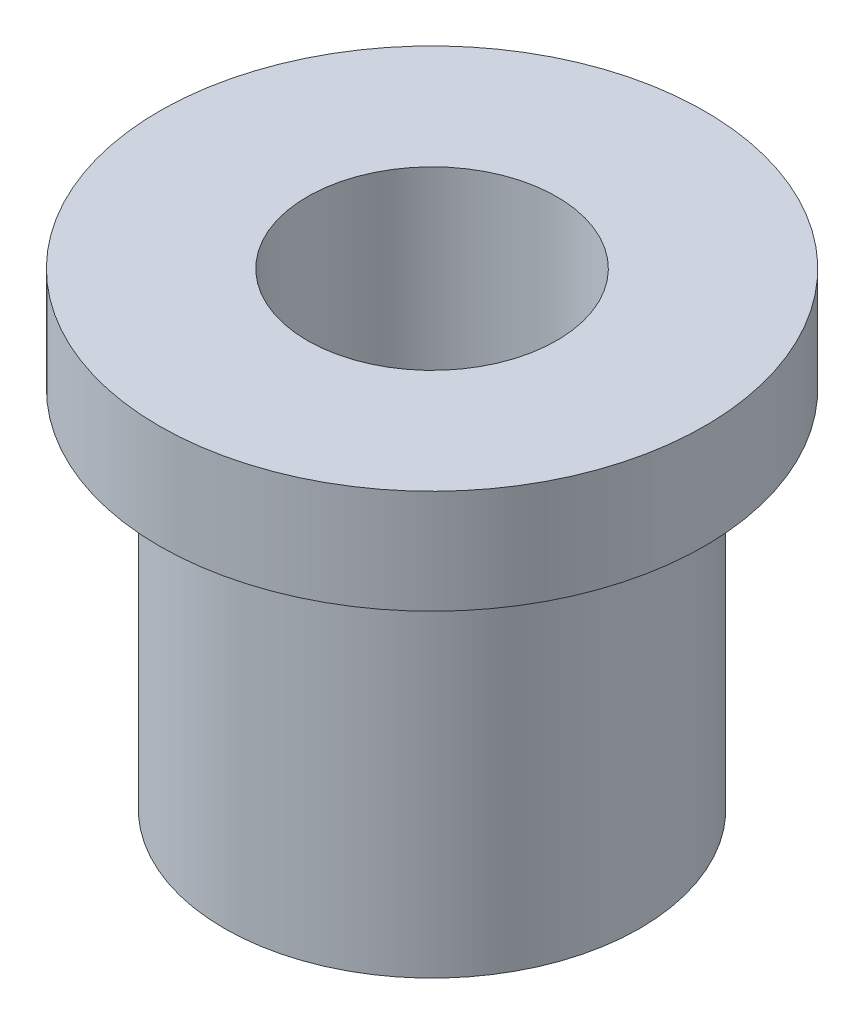
from build123d import *

# Parameters (mm, degrees)
SKETCH1_R           = 4
SKETCH1_R_2         = 2.4
BOSS_EXTRUDE1_DEPTH = 9
BOSS_EXTRUDE2_START = -2
SKETCH2_R           = 5.25
SKETCH2_R_2         = 2.4
BOSS_EXTRUDE2_DEPTH = 2


with BuildPart() as part:
    # Sketch1 → Boss-Extrude1 (new body)
    with BuildSketch(Plane(origin=(0, 0, 0), x_dir=(1, 0, 0), z_dir=(0, 1, 0))):
        with Locations(Location((0, 0, 0), (0, 0, 270))):
            Circle(SKETCH1_R)
        with Locations(Location((0, 0, 0), (0, 0, 270))):
            Circle(SKETCH1_R_2, mode=Mode.SUBTRACT)
    extrude(amount=BOSS_EXTRUDE1_DEPTH)

    # Sketch2 → Boss-Extrude2 (add)
    with BuildSketch(Plane(origin=(0, 9, 0), x_dir=(1, 0, 0), z_dir=(0, 1, 0)).offset(BOSS_EXTRUDE2_START)):
        with Locations(Location((0, 0, 0), (0, 0, 270))):
            Circle(SKETCH2_R)
        with Locations(Location((0, 0, 0), (0, 0, 270))):
            Circle(SKETCH2_R_2, mode=Mode.SUBTRACT)
    extrude(amount=BOSS_EXTRUDE2_DEPTH)


solid = part.part
